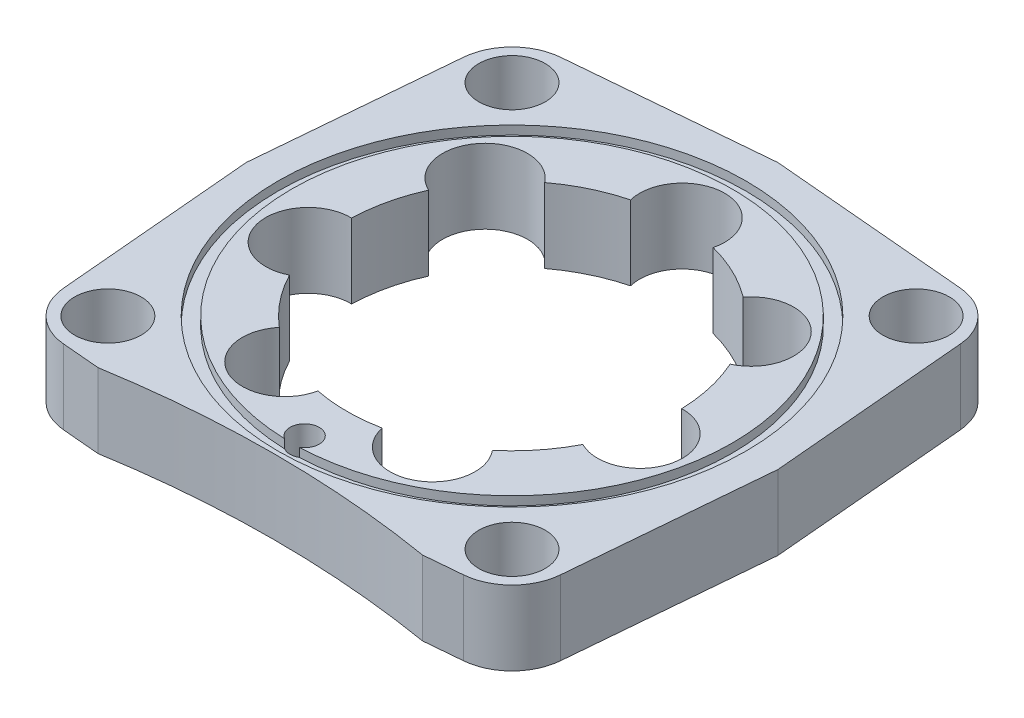
from build123d import *

# Parameters (mm, degrees)
SKETCH1_W           = 100
SKETCH1_H           = 100
SKETCH1_R           = 2.75
BOSS_EXTRUDE1_DEPTH = 14
SKETCH2_R           = 44
SKETCH2_R_2         = 41.4
CUT_EXTRUDE1_DEPTH  = 1.65
SKETCH3_OUTSIDE_W   = 130.422
SKETCH3_OUTSIDE_H   = 130.422
SKETCH3_OUTSIDE_R   = 6.25
CUT_EXTRUDE2_DEPTH  = 73.083285164


with BuildPart() as part:
    # Sketch1 → Boss-Extrude1 (new body)
    with BuildSketch(Plane(origin=(0, 0, 0), x_dir=(1, 0, 0), z_dir=(0, 1, 0))):
        Rectangle(SKETCH1_W, SKETCH1_H)
        with Locations(Location((0, -39, 0), (0, 0, 270))):
            Circle(SKETCH1_R, mode=Mode.SUBTRACT)
        with BuildLine():
            ThreePointArc((7.762235325, 30.064101563), (0, 40), (-7.762235325, 30.064101562))
            ThreePointArc((-7.762235325, 30.064101562), (-13.4720901, 27.975083348), (-18.665386529, 24.813420678))
            ThreePointArc((-18.665386529, 24.813420678), (-31.273259299, 24.939592074), (-28.344735658, 12.675900775))
            ThreePointArc((-28.344735658, 12.675900775), (-30.271511673, 6.909274999), (-31.037591622, 0.877727921))
            ThreePointArc((-31.037591622, 0.877727921), (-38.997116487, -8.900837358), (-27.583071914, -14.257511837))
            ThreePointArc((-27.583071914, -14.257511837), (-24.275867531, -19.359358348), (-20.037857172, -23.718911863))
            ThreePointArc((-20.037857172, -23.718911863), (-17.355349565, -36.038754716), (-6.050792426, -30.454727236))
            ThreePointArc((-6.050792426, -30.454727236), (0, -31.05), (6.050792426, -30.454727236))
            ThreePointArc((6.050792426, -30.454727236), (17.355349565, -36.038754716), (20.037857172, -23.718911863))
            ThreePointArc((20.037857172, -23.718911863), (24.275867531, -19.359358348), (27.583071914, -14.257511837))
            ThreePointArc((27.583071914, -14.257511837), (38.997116487, -8.900837358), (31.037591622, 0.877727921))
            ThreePointArc((31.037591622, 0.877727921), (30.271511673, 6.909274999), (28.344735658, 12.675900775))
            ThreePointArc((28.344735658, 12.675900775), (31.273259299, 24.939592074), (18.665386529, 24.813420678))
            ThreePointArc((18.665386529, 24.813420678), (13.4720901, 27.975083348), (7.762235325, 30.064101563))
        make_face(mode=Mode.SUBTRACT)
    extrude(amount=BOSS_EXTRUDE1_DEPTH)

    # Sketch2 → Cut-Extrude1 (cut)
    with BuildSketch(Plane(origin=(0, 14, 0), x_dir=(1, 0, 0), z_dir=(0, 1, 0))):
        with Locations(Location((0, 0, 0), (0, 0, 270))):
            Circle(SKETCH2_R)
        Circle(SKETCH2_R_2, mode=Mode.SUBTRACT)
    extrude(amount=-CUT_EXTRUDE1_DEPTH, mode=Mode.SUBTRACT)

    # Sketch3 outside → Cut-Extrude2 (cut, through all)
    # profile 1 of 5: a face of its own
    with BuildSketch(Plane(origin=(0, 14, 0), x_dir=(1, 0, 0), z_dir=(0, 1, 0))):
        Rectangle(SKETCH3_OUTSIDE_W, SKETCH3_OUTSIDE_H)
        with BuildLine():
            Line((0, 50), (-37.618424742, 46.708814295))
            ThreePointArc((-37.618424742, 46.708814295), (-43.817935126, 43.817935126), (-46.708814295, 37.618424742))
            Line((-46.708814295, 37.618424742), (-50, 0))
            Line((-50, 0), (-46.708814295, -37.618424742))
            ThreePointArc((-46.708814295, -37.618424742), (-43.817935126, -43.817935126), (-37.618424742, -46.708814295))
            Line((-37.618424742, -46.708814295), (-30.5, -47.331595762))
            ThreePointArc((-30.5, -47.331595762), (0, -44.8), (30.5, -47.331595762))
            Line((30.5, -47.331595762), (37.618424742, -46.708814295))
            ThreePointArc((37.618424742, -46.708814295), (43.817935126, -43.817935126), (46.708814295, -37.618424742))
            Line((46.708814295, -37.618424742), (50, 0))
            Line((50, 0), (46.708814295, 37.618424742))
            ThreePointArc((46.708814295, 37.618424742), (43.817935126, 43.817935126), (37.618424742, 46.708814295))
            Line((37.618424742, 46.708814295), (0, 50))
        make_face(mode=Mode.SUBTRACT)
    # profile 2 of 5: a face of its own
    with BuildSketch(Plane(origin=(0, 14, 0), x_dir=(1, 0, 0), z_dir=(0, 1, 0))):
        with Locations(Location((-38, 38, 0), (0, 0, 270))):
            Circle(SKETCH3_OUTSIDE_R)
    # profile 3 of 5: a face of its own
    with BuildSketch(Plane(origin=(0, 14, 0), x_dir=(1, 0, 0), z_dir=(0, 1, 0))):
        with Locations(Location((38, 38, 0), (0, 0, 90))):
            Circle(SKETCH3_OUTSIDE_R)
    # profile 4 of 5: a face of its own
    with BuildSketch(Plane(origin=(0, 14, 0), x_dir=(1, 0, 0), z_dir=(0, 1, 0))):
        with Locations(Location((38, -38, 0), (0, 0, 270))):
            Circle(SKETCH3_OUTSIDE_R)
    # profile 5 of 5: a face of its own
    with BuildSketch(Plane(origin=(0, 14, 0), x_dir=(1, 0, 0), z_dir=(0, 1, 0))):
        with Locations(Location((-38, -38, 0), (0, 0, 90))):
            Circle(SKETCH3_OUTSIDE_R)
    extrude(amount=-CUT_EXTRUDE2_DEPTH, mode=Mode.SUBTRACT)


solid = part.part
